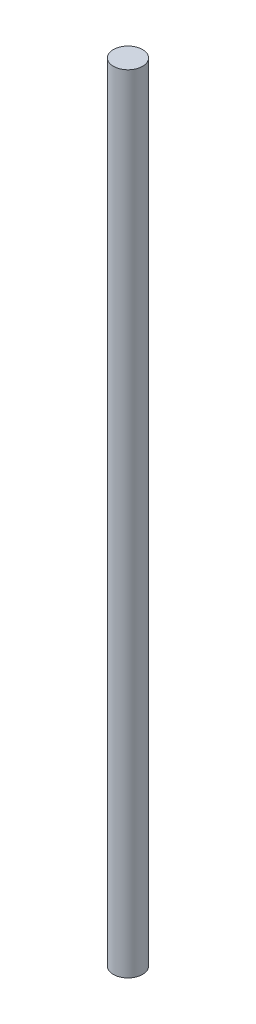
from build123d import *

# Parameters (mm, degrees)
SKETCH1_R           = 3.175
BOSS_EXTRUDE1_DEPTH = 171.45


with BuildPart() as part:
    # Sketch1 → Boss-Extrude1 (new body)
    with BuildSketch(Plane(origin=(0, 0, 0), x_dir=(1, 0, 0), z_dir=(0, 1, 0))):
        with Locations(Location((0, 0, 0), (0, 0, 270))):
            Circle(SKETCH1_R)
    extrude(amount=BOSS_EXTRUDE1_DEPTH)


solid = part.part
